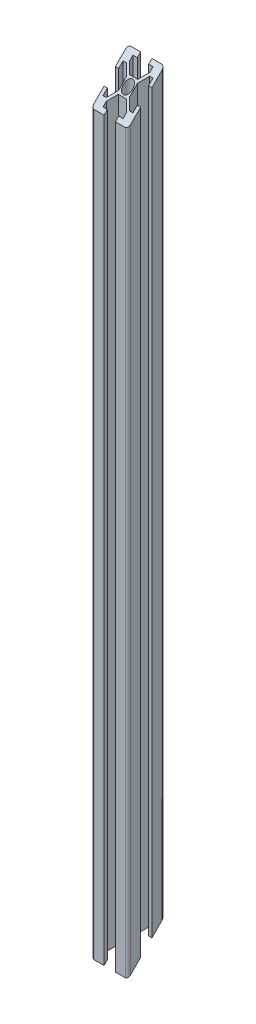
from build123d import *

# Parameters (mm, degrees)
SKETCH_1_R          = 2.5
EXTRUDE_1_DEPTH     = 423.22
CUT_EXTRUDE_2_DEPTH = 424.857928392


with BuildPart() as part:
    # 草图1 → 凸台-拉伸1 (new body)
    with BuildSketch(Plane(origin=(0, 0, 0), x_dir=(1, 0, 0), z_dir=(0, 1, 0))):
        with BuildLine():
            Line((-6.856001319, -4.947998187), (-8.656001319, -4.947998187))
            Line((-8.656001319, -4.947998187), (-8.656001319, -10.347998187))
            ThreePointArc((-8.656001319, -10.347998187), (-8.216661491, -11.408658358), (-7.156001319, -11.847998187))
            Line((-7.156001319, -11.847998187), (-1.756001319, -11.847998187))
            Line((-1.756001319, -11.847998187), (-1.756001319, -10.047998187))
            Line((-1.756001319, -10.047998187), (-4.156001319, -10.047998187))
            Line((-4.156001319, -10.047998187), (-4.156001319, -8.245048342))
            Line((-4.156001319, -8.245048342), (-0.858951164, -4.947998187))
            Line((-0.858951164, -4.947998187), (3.546948526, -4.947998187))
            Line((3.546948526, -4.947998187), (6.843998681, -8.245048342))
            Line((6.843998681, -8.245048342), (6.843998681, -10.047998187))
            Line((6.843998681, -10.047998187), (4.443998681, -10.047998187))
            Line((4.443998681, -10.047998187), (4.443998681, -11.847998187))
            Line((4.443998681, -11.847998187), (9.843998681, -11.847998187))
            ThreePointArc((9.843998681, -11.847998187), (10.904658853, -11.408658358), (11.343998681, -10.347998187))
            Line((11.343998681, -10.347998187), (11.343998681, -4.947998187))
            Line((11.343998681, -4.947998187), (9.543998681, -4.947998187))
            Line((9.543998681, -4.947998187), (9.543998681, -7.347998187))
            Line((9.543998681, -7.347998187), (7.741048836, -7.347998187))
            Line((7.741048836, -7.347998187), (4.398125701, -4.005075052))
            Line((4.398125701, -4.005075052), (4.398125701, 0.309078679))
            Line((4.398125701, 0.309078679), (7.741048836, 3.652001813))
            Line((7.741048836, 3.652001813), (9.543998681, 3.652001813))
            Line((9.543998681, 3.652001813), (9.543998681, 1.252001813))
            Line((9.543998681, 1.252001813), (11.343998681, 1.252001813))
            Line((11.343998681, 1.252001813), (11.343998681, 6.652001813))
            ThreePointArc((11.343998681, 6.652001813), (10.904658853, 7.712661985), (9.843998681, 8.152001813))
            Line((9.843998681, 8.152001813), (4.443998681, 8.152001813))
            Line((4.443998681, 8.152001813), (4.443998681, 6.352001813))
            Line((4.443998681, 6.352001813), (6.843998681, 6.352001813))
            Line((6.843998681, 6.352001813), (6.843998681, 4.549051969))
            Line((6.843998681, 4.549051969), (3.546948526, 1.252001813))
            Line((3.546948526, 1.252001813), (-0.858951164, 1.252001813))
            Line((-0.858951164, 1.252001813), (-4.156001319, 4.549051969))
            Line((-4.156001319, 4.549051969), (-4.156001319, 6.352001813))
            Line((-4.156001319, 6.352001813), (-1.756001319, 6.352001813))
            Line((-1.756001319, 6.352001813), (-1.756001319, 8.152001813))
            Line((-1.756001319, 8.152001813), (-7.156001319, 8.152001813))
            ThreePointArc((-7.156001319, 8.152001813), (-8.216661491, 7.712661985), (-8.656001319, 6.652001813))
            Line((-8.656001319, 6.652001813), (-8.656001319, 1.252001813))
            Line((-8.656001319, 1.252001813), (-6.856001319, 1.252001813))
            Line((-6.856001319, 1.252001813), (-6.856001319, 3.652001813))
            Line((-6.856001319, 3.652001813), (-5.053051474, 3.652001813))
            Line((-5.053051474, 3.652001813), (-1.710128339, 0.309078679))
            Line((-1.710128339, 0.309078679), (-1.710128339, -4.005075052))
            Line((-1.710128339, -4.005075052), (-5.053051474, -7.347998187))
            Line((-5.053051474, -7.347998187), (-6.856001319, -7.347998187))
            Line((-6.856001319, -7.347998187), (-6.856001319, -4.947998187))
        make_face()
        with Locations(Location((1.343998681, -1.847998187, 0), (0, 0, 270))):
            Circle(SKETCH_1_R, mode=Mode.SUBTRACT)
    extrude(amount=EXTRUDE_1_DEPTH)

    # 草图3 → 切除-拉伸2 (cut, through all)
    with BuildSketch(Plane.ZY.offset(8.656001319)):
        Polygon((-8.152001813, 423.22), (11.847998187, 403.22), (11.847998187, 423.22), align=None)
        Polygon((11.847998187, 0), (-8.152001813, 20), (-8.152001813, 0), align=None)
    extrude(amount=-CUT_EXTRUDE_2_DEPTH, mode=Mode.SUBTRACT)


solid = part.part
